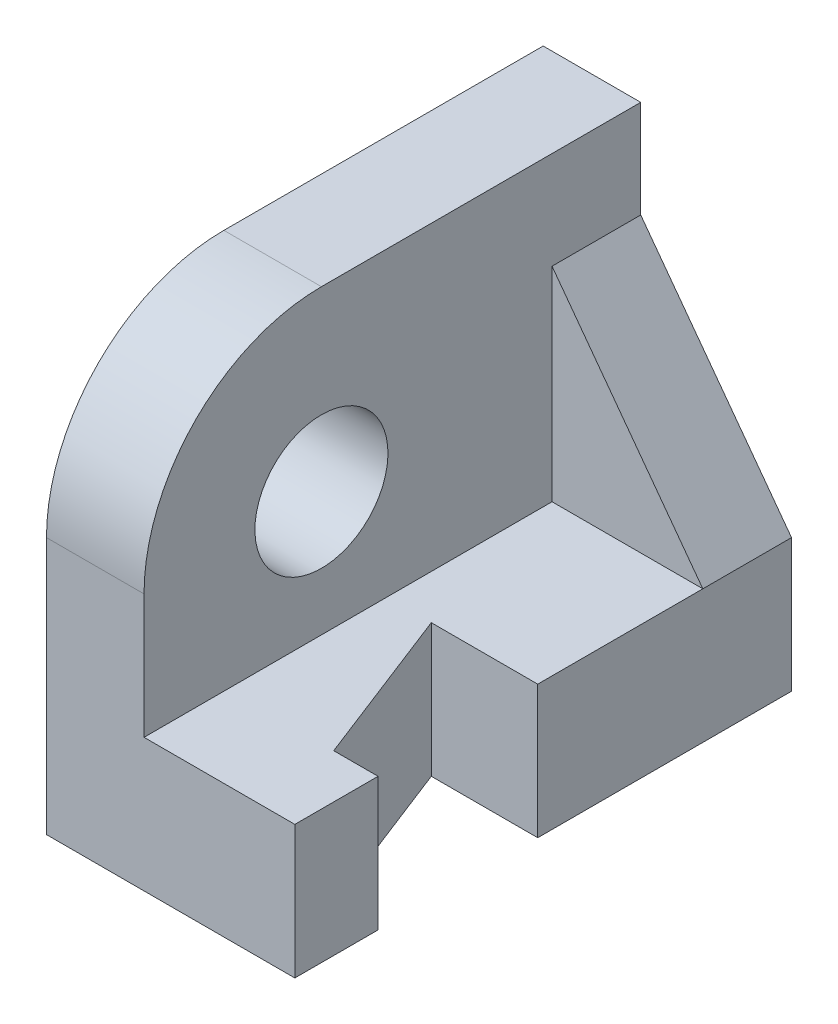
from build123d import *

# Parameters (mm, degrees)
Y_KSEKLIK_EKSTR_ZYON1_DEPTH = 56
RADYUS1_R                   = 20
KES_EKSTR_ZYON1_REACH       = 65.522
IZIM2_R                     = 7.5
KES_EKSTR_ZYON2_DEPTH       = 91.210054598
KES_EKSTR_ZYON2_DEPTH_BACK  = 91.210054598
FEDER1_REACH                = 89.131
IZIM4_WALL_W                = 204.86364479
IZIM4_WALL_H                = 10


with BuildPart() as part:
    # Çizim1 → Yükseklik-Ekstrüzyon1 (new body)
    with BuildSketch(Plane.XY):
        Polygon((-62.014949412, 24.698979592), (-51.014949412, 24.698979592), (-51.014949412, -9.301020408), (-34.014949412, -9.301020408), (-34.014949412, -24.301020408), (-51.014949412, -24.301020408), (-62.014949412, -24.301020408), align=None)
    extrude(amount=Y_KSEKLIK_EKSTR_ZYON1_DEPTH)

    # Radyus1
    radyus1_edges = [part.edges().sort_by_distance(p)[0] for p in [
        (-56.514949412, 24.698979592, 56),
    ]]
    fillet(radyus1_edges, radius=RADYUS1_R)

    # Çizim2 → Kes-Ekstrüzyon1 (cut, up to next)
    with BuildSketch(Plane(origin=(-51.014949412, 0, 0), x_dir=(0, 0, -1), z_dir=(1, 0, 0)), mode=Mode.PRIVATE) as kes_ekstr_zyon1_sk1:
        with Locations(Location((-36, 4.698979592, 0), (0, 0, 90))):
            Circle(IZIM2_R)
    kes_ekstr_zyon1_tool1 = extrude(kes_ekstr_zyon1_sk1.sketch, amount=-KES_EKSTR_ZYON1_REACH, mode=Mode.PRIVATE) & part.part
    add(kes_ekstr_zyon1_tool1.solids().sort_by_distance((-51.014949, 4.69898, 36))[0], mode=Mode.SUBTRACT)

    # Çizim3 → Kes-Ekstrüzyon2 (cut, two sides: drawn at the far end of the back side and taken through both)
    with BuildSketch(Plane(origin=(0, -9.301020408, 0), x_dir=(1, 0, 0), z_dir=(0, 1, 0)).offset(-KES_EKSTR_ZYON2_DEPTH_BACK)):
        Polygon((84.737919905, -28.613266847), (-34.014949412, -28.613266847), (-46.014949412, -28.613266847), (-39.014949412, -46.613266847), (-34.014949412, -46.613266847), (84.737919905, -46.613266847), (322.24365854, -46.613266847), (322.24365854, -28.613266847), align=None)
    extrude(amount=KES_EKSTR_ZYON2_DEPTH + KES_EKSTR_ZYON2_DEPTH_BACK, mode=Mode.SUBTRACT)

    # Çizim4 wall → Feder1 (add, up to next)
    with BuildSketch(Plane(origin=(-42.514949412, 2.198979592, 0), x_dir=(-0.594391061084, 0.804176141466, 0), z_dir=(0.804176141466, 0.594391061084, 0)), mode=Mode.PRIVATE) as feder1_sk1:
        with Locations((0, 5)):
            Rectangle(IZIM4_WALL_W, IZIM4_WALL_H)
    feder1_tool1 = extrude(feder1_sk1.sketch, amount=-FEDER1_REACH, mode=Mode.PRIVATE) - part.part
    add(feder1_tool1.solids().sort_by_distance((-42.514949412, 2.198979592, 0))[0])


solid = part.part
